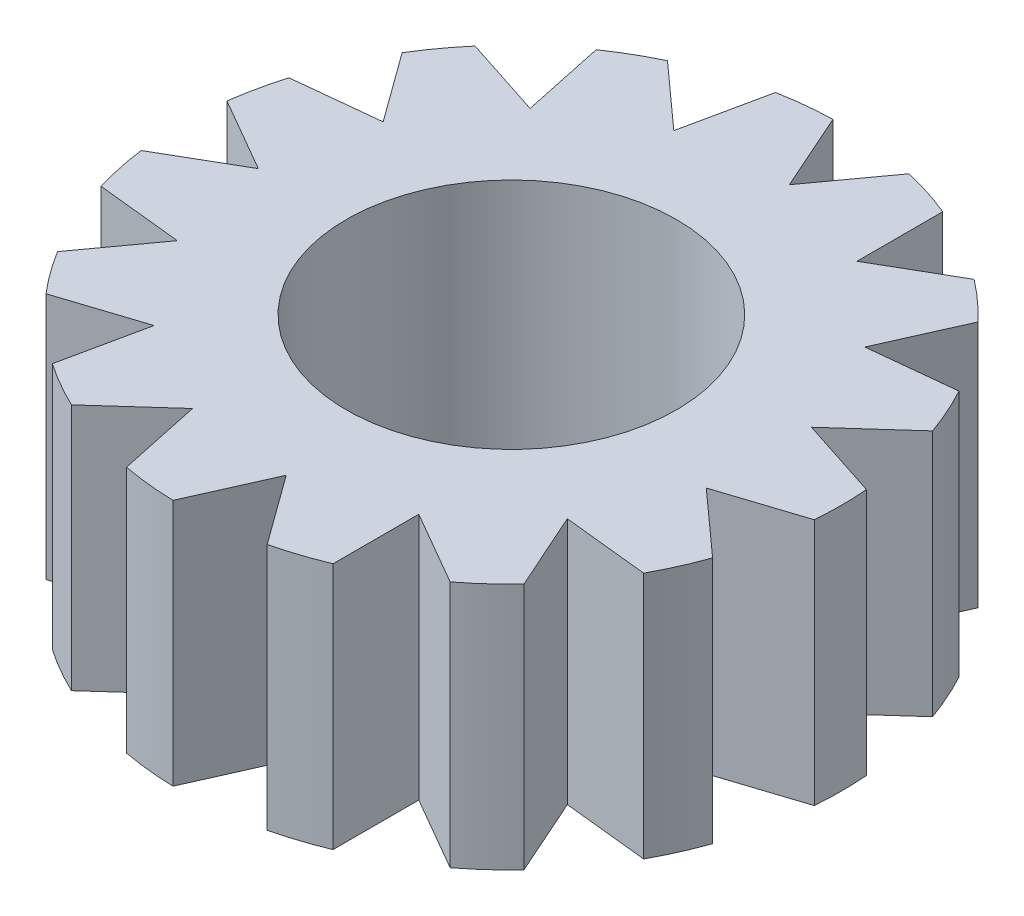
from build123d import *

# Parameters (mm, degrees)
SKETCH_2_W               = 20
SKETCH_2_H               = 30
CUT_EXTRUDE_1_DEPTH      = 65.031242374
PATTERN_CIRCULAR_2_COUNT = 15


with BuildPart() as part:
    # 草图2 → 旋转1 (revolve)
    with BuildSketch(Plane.XY, mode=Mode.PRIVATE) as revolve_1_sk:
        with Locations((-30, 15)):
            Rectangle(SKETCH_2_W, SKETCH_2_H)
    revolve(revolve_1_sk.sketch.rotate(Axis((0, 0, 0), (0, 1, 0)), 270), axis=Axis((0, 0, 0), (0, 1, 0)))

    # 草图3 → 切除-拉伸1 (cut, through all)
    with BuildSketch(Plane(origin=(0, 30, 0), x_dir=(1, 0, 0), z_dir=(0, 1, 0))):
        Polygon((-30.66106403, 0), (-39.66106403, 5.196152423), (-48.66106403, 0), (-39.66106403, -5.196152423), align=None)
    cut_extrude_1 = extrude(amount=-CUT_EXTRUDE_1_DEPTH, mode=Mode.SUBTRACT)

    # 阵列(圆周)2: 切除-拉伸1 ×15 about axis
    pattern_circular_2_axis = Axis((0, 0, 0), (0, 1, 0))
    for i in range(1, PATTERN_CIRCULAR_2_COUNT):
        add(cut_extrude_1.rotate(pattern_circular_2_axis, i * 360 / PATTERN_CIRCULAR_2_COUNT), mode=Mode.SUBTRACT)


solid = part.part
